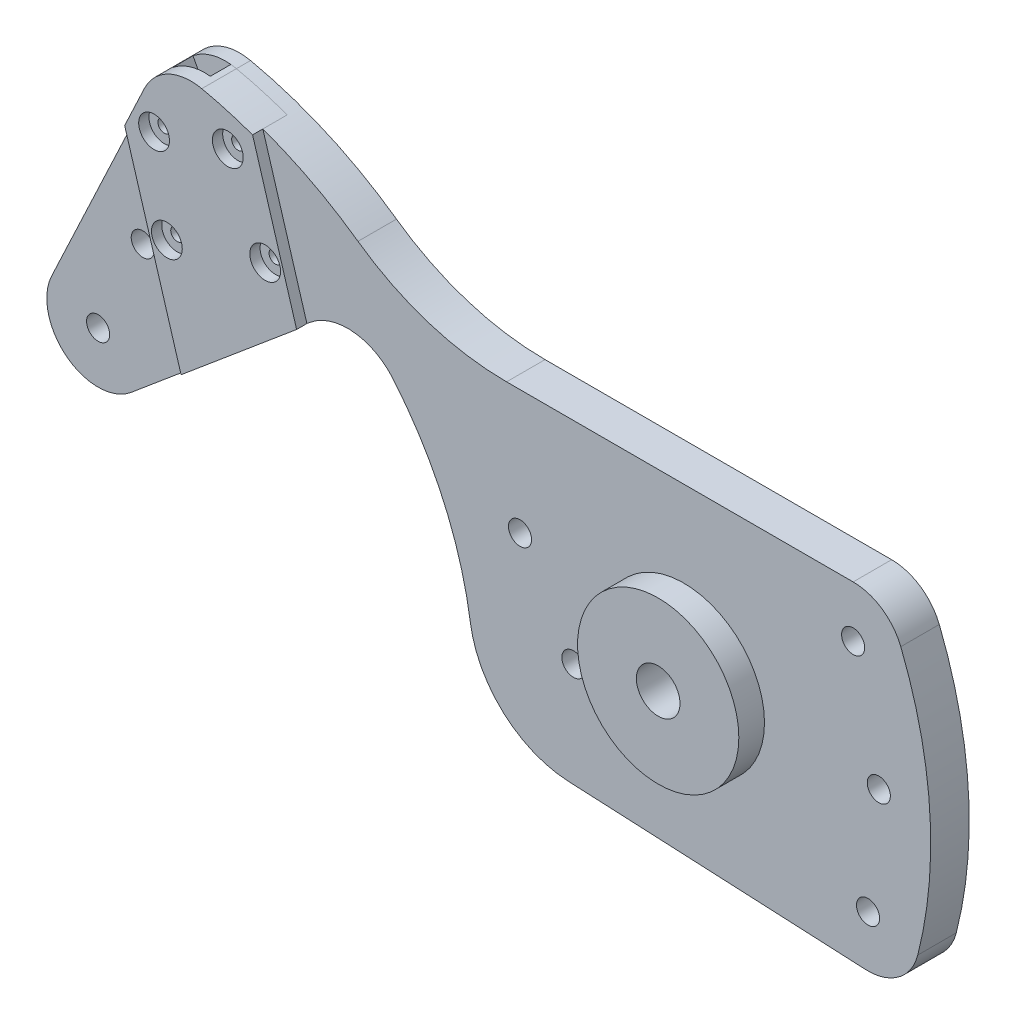
from build123d import *

# Parameters (mm, degrees)
SKETCH1_R              = 4.25
SKETCH1_R_2            = 2.25
BOSS_EXTRUDE1_DEPTH    = 4.75
CUT_EXTRUDE1_DEPTH     = 2
SKETCH4_R              = 1.25
CUT_EXTRUDE2_DEPTH     = 136.849086626
SKETCH5_R              = 3
CUT_EXTRUDE3_DEPTH     = 2
SPLIT3_SURFACE_1_BACK  = 193.818
SPLIT3_SURFACE_1_DEPTH = 387.636
SPLIT3_SURFACE_2_BACK  = 193.818
SPLIT3_SURFACE_2_DEPTH = 387.636
SKETCH6_R              = 15.710018396
CUT_EXTRUDE4_DEPTH     = 2
SKETCH7_R              = 15.710018396
SKETCH7_R_2            = 4.25
BOSS_EXTRUDE2_DEPTH    = 3


with BuildPart() as part:
    # Sketch1 → Boss-Extrude1 (new, symmetric)
    with BuildSketch(Plane.XY):
        with BuildLine():
            Line((-22.500230832, -28.983987123), (35.398437983, -31.788291003))
            ThreePointArc((35.398437983, -31.788291003), (41.825152283, -29.842482755), (45.572267137, -24.270413418))
            ThreePointArc((45.572267137, -24.270413418), (47.922199842, 1.185089324), (42.266415188, 26.115330067))
            ThreePointArc((42.266415188, 26.115330067), (38.587871094, 30.681102), (32.982217728, 32.4))
            Line((32.982217728, 32.4), (-34.53815208, 32.4))
            ThreePointArc((-34.53815208, 32.4), (-49.730929753, 34.764094355), (-63.487021029, 41.632819737))
            ThreePointArc((-63.487021029, 41.632819737), (-77.067258547, 49.344582351), (-91.918742124, 54.174444589))
            ThreePointArc((-91.918742124, 54.174444589), (-98.466295495, 53.366674665), (-103.085929893, 48.656905518))
            Line((-103.085929893, 48.656905518), (-123.167077545, 5.955614534))
            ThreePointArc((-123.167077545, 5.955614534), (-120.218280198, -6.2236308), (-107.689906175, -5.960444431))
            Line((-107.689906175, -5.960444431), (-72.864818345, 23.261273923))
            ThreePointArc((-72.864818345, 23.261273923), (-64.470178387, 25.908093735), (-56.662687309, 21.843771132))
            ThreePointArc((-56.662687309, 21.843771132), (-46.809939593, 6.135423294), (-41.608278072, -11.662653759))
            ThreePointArc((-41.608278072, -11.662653759), (-35.156858245, -23.745961099), (-22.500230832, -28.983987123))
        make_face()
        Circle(SKETCH1_R, mode=Mode.SUBTRACT)
        with Locations((35.882217728, -21.8)):
            Circle(SKETCH1_R_2, mode=Mode.SUBTRACT)
        with Locations((-21.517782272, -8.7)):
            Circle(SKETCH1_R_2, mode=Mode.SUBTRACT)
        with Locations((37.982217728, -0.1)):
            Circle(SKETCH1_R_2, mode=Mode.SUBTRACT)
        with Locations((32.982217728, 22.4)):
            Circle(SKETCH1_R_2, mode=Mode.SUBTRACT)
        with Locations((-31.917782272, 8.2)):
            Circle(SKETCH1_R_2, mode=Mode.SUBTRACT)
        with Locations((-105.417782272, 20.2)):
            Circle(SKETCH1_R_2, mode=Mode.SUBTRACT)
        with Locations((-114.117782272, 1.7)):
            Circle(SKETCH1_R_2, mode=Mode.SUBTRACT)
    extrude(amount=BOSS_EXTRUDE1_DEPTH, both=True)

    # Sketch2 → Cut-Extrude1 (cut, symmetric)
    with BuildSketch(Plane.XY):
        with BuildLine():
            Line((-78.227129447, 18.761760655), (-92.084556702, 44.987885053))
            Line((-92.084556702, 44.987885053), (-93.002217677, 54.347646176))
            ThreePointArc((-93.002217677, 54.347646176), (-96.914482214, 53.978242129), (-100.382341665, 52.129939126))
            Line((-100.382341665, 52.129939126), (-95.988712538, 43.814696915))
            Line((-95.988712538, 43.814696915), (-92.369017313, 6.895307763))
            Line((-92.369017313, 6.895307763), (-78.227129447, 18.761760655))
        make_face()
    extrude(amount=CUT_EXTRUDE1_DEPTH, both=True, mode=Mode.SUBTRACT)

    # Sketch4 → Cut-Extrude2 (cut, through all)
    with BuildSketch(Plane.XY.offset(4.75)):
        with Locations((-98.721244854, 25.242626445)):
            Circle(SKETCH4_R)
        with Locations((-101.219347979, 42.242905289)):
            Circle(SKETCH4_R)
        with Locations((-86.853921262, 46.55967668)):
            Circle(SKETCH4_R)
        with Locations((-79.567342565, 30.998321633)):
            Circle(SKETCH4_R)
    extrude(amount=-CUT_EXTRUDE2_DEPTH, mode=Mode.SUBTRACT)

    # Sketch5 → Cut-Extrude3 (cut)
    with BuildSketch(Plane.XY.offset(4.75)):
        with Locations((-101.219347979, 42.242905289)):
            Circle(SKETCH5_R)
        with Locations((-86.853921262, 46.55967668)):
            Circle(SKETCH5_R)
        with Locations((-79.567342565, 30.998321633)):
            Circle(SKETCH5_R)
        with Locations((-98.721244854, 25.242626445)):
            Circle(SKETCH5_R)
    extrude(amount=-CUT_EXTRUDE3_DEPTH, mode=Mode.SUBTRACT)


with BuildPart() as body_2:
    # Split3: the piece behind the surface
    add(part.part)
    # Split3 surface: a surface, the sketch's curves swept straight by 387.636 mm
    with BuildLine(Plane(origin=(-20.02556284, 66.641415389, 0), x_dir=(0.9576951144500195, 0.2877847594271872, 0), z_dir=(-0.2877847594271872, 0.9576951144500195, 0)).offset(-SPLIT3_SURFACE_1_BACK), mode=Mode.PRIVATE) as split3_surface_1_path:
        Line((-63.780410711, -4.75), (-63.780410711, 2))
        Line((-63.780410711, 2), (-90.780410711, 2))
        Line((-90.780410711, 2), (-90.780410711, -4.75))
    split3_surface_1 = Shell.extrude(split3_surface_1_path.wire(), (-0.287784759 * SPLIT3_SURFACE_1_DEPTH, 0.957695114 * SPLIT3_SURFACE_1_DEPTH, 0 * SPLIT3_SURFACE_1_DEPTH))
    split(bisect_by=split3_surface_1, keep=Keep.BOTTOM)

    # Sketch6 → Cut-Extrude4 (cut)
    # profile 1 of 2: a face of its own
    with BuildSketch(Plane.XY.offset(4.75)):
        with BuildLine():
            Line((-95.957666069, 3.884073915), (-106.945535827, 40.449697498))
            Line((-106.945535827, 40.449697498), (-123.167077545, 5.955614534))
            ThreePointArc((-123.167077545, 5.955614534), (-120.218280198, -6.2236308), (-107.689906175, -5.960444431))
            Line((-107.689906175, -5.960444431), (-95.957666069, 3.884073915))
        make_face()
    # profile 2 of 2: a face of its own
    with BuildSketch(Plane.XY.offset(4.75)):
        with BuildLine():
            Line((-82.022097036, 51.329163249), (-73.442190431, 22.776801219))
            Line((-73.442190431, 22.776801219), (-72.864818345, 23.261273923))
            ThreePointArc((-72.864818345, 23.261273923), (-64.470178387, 25.908093735), (-56.662687309, 21.843771132))
            ThreePointArc((-56.662687309, 21.843771132), (-46.809939593, 6.135423294), (-41.608278072, -11.662653759))
            ThreePointArc((-41.608278072, -11.662653759), (-35.156858245, -23.745961099), (-22.500230832, -28.983987123))
            Line((-22.500230832, -28.983987123), (35.398437983, -31.788291003))
            ThreePointArc((35.398437983, -31.788291003), (41.825152283, -29.842482755), (45.572267137, -24.270413418))
            ThreePointArc((45.572267137, -24.270413418), (47.922199842, 1.185089324), (42.266415188, 26.115330067))
            ThreePointArc((42.266415188, 26.115330067), (38.587871094, 30.681102), (32.982217728, 32.4))
            Line((32.982217728, 32.4), (-34.53815208, 32.4))
            ThreePointArc((-34.53815208, 32.4), (-49.730929753, 34.764094355), (-63.487021029, 41.632819737))
            ThreePointArc((-63.487021029, 41.632819737), (-72.425615765, 47.109784033), (-82.022097036, 51.329163249))
        make_face()
        Circle(SKETCH6_R, mode=Mode.SUBTRACT)
    extrude(amount=-CUT_EXTRUDE4_DEPTH, mode=Mode.SUBTRACT)

    # Sketch7 → Boss-Extrude2 (add)
    with BuildSketch(Plane.XY.offset(4.75)):
        Circle(SKETCH7_R)
        Circle(SKETCH7_R_2, mode=Mode.SUBTRACT)
    extrude(amount=BOSS_EXTRUDE2_DEPTH)


with BuildPart() as part_1:
    add(part.part)

    # Split3: split by a surface, the side it looks to stays
    # Split3 surface: a surface, the sketch's curves swept straight by 387.636 mm
    with BuildLine(Plane(origin=(-20.02556284, 66.641415389, 0), x_dir=(0.9576951144500195, 0.2877847594271872, 0), z_dir=(-0.2877847594271872, 0.9576951144500195, 0)).offset(-SPLIT3_SURFACE_2_BACK), mode=Mode.PRIVATE) as split3_surface_2_path:
        Line((-63.780410711, -4.75), (-63.780410711, 2))
        Line((-63.780410711, 2), (-90.780410711, 2))
        Line((-90.780410711, 2), (-90.780410711, -4.75))
    split3_surface_2 = Shell.extrude(split3_surface_2_path.wire(), (-0.287784759 * SPLIT3_SURFACE_2_DEPTH, 0.957695114 * SPLIT3_SURFACE_2_DEPTH, 0 * SPLIT3_SURFACE_2_DEPTH))
    split(bisect_by=split3_surface_2, keep=Keep.TOP)


solid = Compound([body_2.part, part_1.part])
